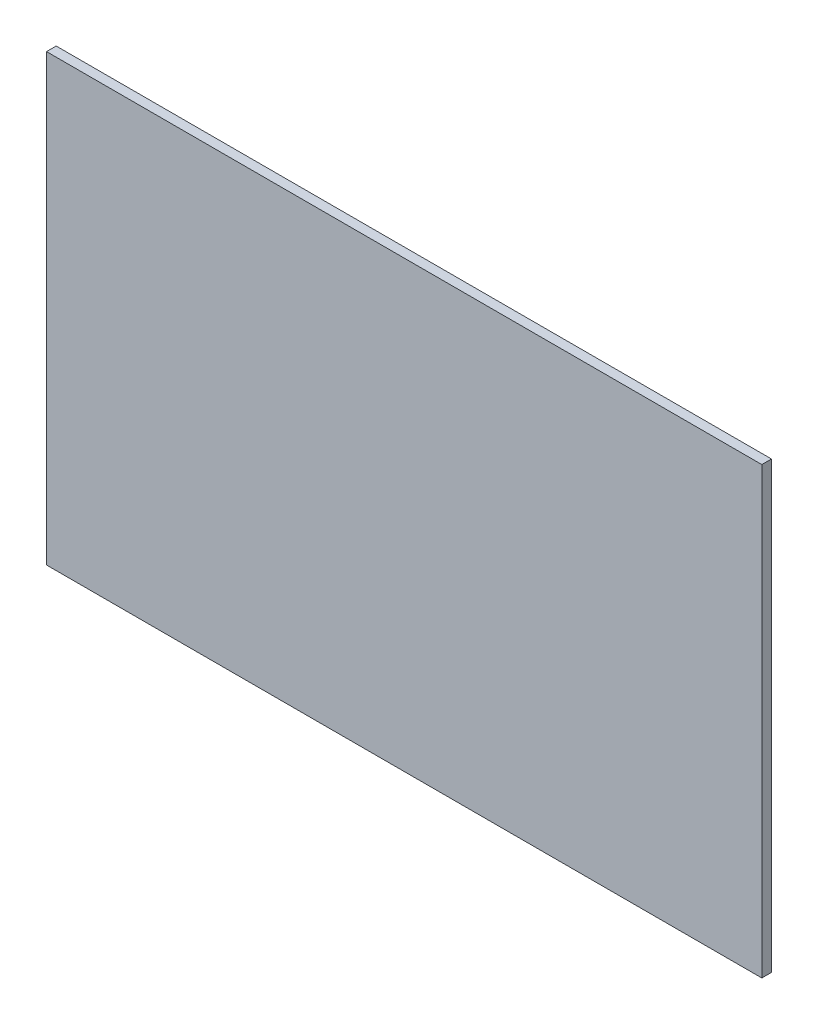
from build123d import *

# Parameters (mm, degrees)
SKETCH1_W           = 469.9
SKETCH1_H           = 292.1
BOSS_EXTRUDE1_DEPTH = 6.35


with BuildPart() as part:
    # Sketch1 → Boss-Extrude1 (new body)
    with BuildSketch(Plane.XY):
        with Locations((234.95, 146.05)):
            Rectangle(SKETCH1_W, SKETCH1_H)
    extrude(amount=BOSS_EXTRUDE1_DEPTH)


solid = part.part
